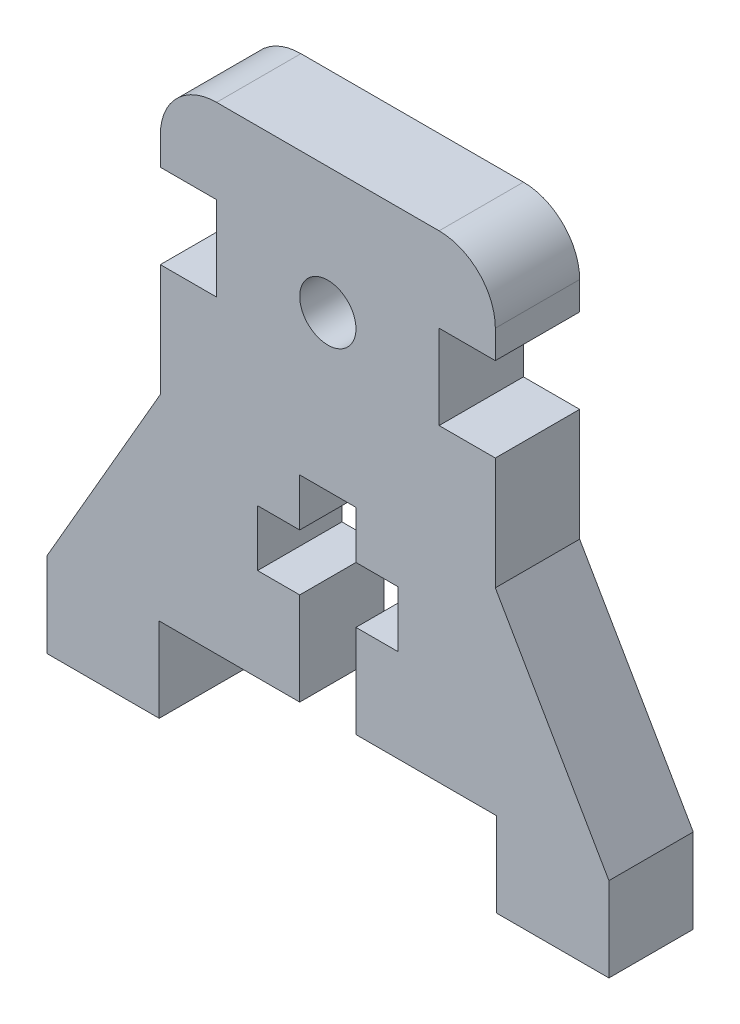
from build123d import *

# Parameters (mm, degrees)
BOSS_EXTRU_1_DEPTH      = 15
ESQUISSE3_R             = 5
ESQUISSE3_W             = 60
ESQUISSE3_H             = 15
ESQUISSE3_W_2           = 10
ESQUISSE3_H_2           = 50
ESQUISSE3_W_3           = 25
ESQUISSE3_H_3           = 10
ENL_V_MAT_EXTRU_1_DEPTH = 15


with BuildPart() as part:
    # Esquisse2 → Boss.-Extru.1 (new body)
    with BuildSketch(Plane.XY):
        with BuildLine():
            Line((-50, 0), (50, 0))
            Line((50, 0), (50, 15))
            Line((50, 15), (29.792740578, 50))
            Line((29.792740578, 50), (29.792740578, 70))
            Line((29.792740578, 70), (19.792740578, 70))
            Line((19.792740578, 70), (19.792740578, 85))
            Line((19.792740578, 85), (29.792740578, 85))
            Line((29.792740578, 85), (29.792740578, 90))
            ThreePointArc((29.792740578, 90), (26.86380839, 97.071067812), (19.792740578, 100))
            Line((19.792740578, 100), (-19.792740578, 100))
            ThreePointArc((-19.792740578, 100), (-26.86380839, 97.071067812), (-29.792740578, 90))
            Line((-29.792740578, 90), (-29.792740578, 85))
            Line((-29.792740578, 85), (-19.792740578, 85))
            Line((-19.792740578, 85), (-19.792740578, 70))
            Line((-19.792740578, 70), (-29.792740578, 70))
            Line((-29.792740578, 70), (-29.792740578, 50))
            Line((-29.792740578, 50), (-50, 15))
            Line((-50, 15), (-50, 0))
        make_face()
    extrude(amount=BOSS_EXTRU_1_DEPTH)

    # Esquisse3 → Enlèv. mat.-Extru.1 (cut)
    with BuildSketch(Plane.XY.offset(15)):
        with Locations((0, 77.5)):
            Circle(ESQUISSE3_R)
        with Locations((0, 7.5)):
            Rectangle(ESQUISSE3_W, ESQUISSE3_H)
        with Locations((0, 25)):
            Rectangle(ESQUISSE3_W_2, ESQUISSE3_H_2)
        with Locations((0, 36.515847226)):
            Rectangle(ESQUISSE3_W_3, ESQUISSE3_H_3)
    extrude(amount=-ENL_V_MAT_EXTRU_1_DEPTH, mode=Mode.SUBTRACT)


solid = part.part
